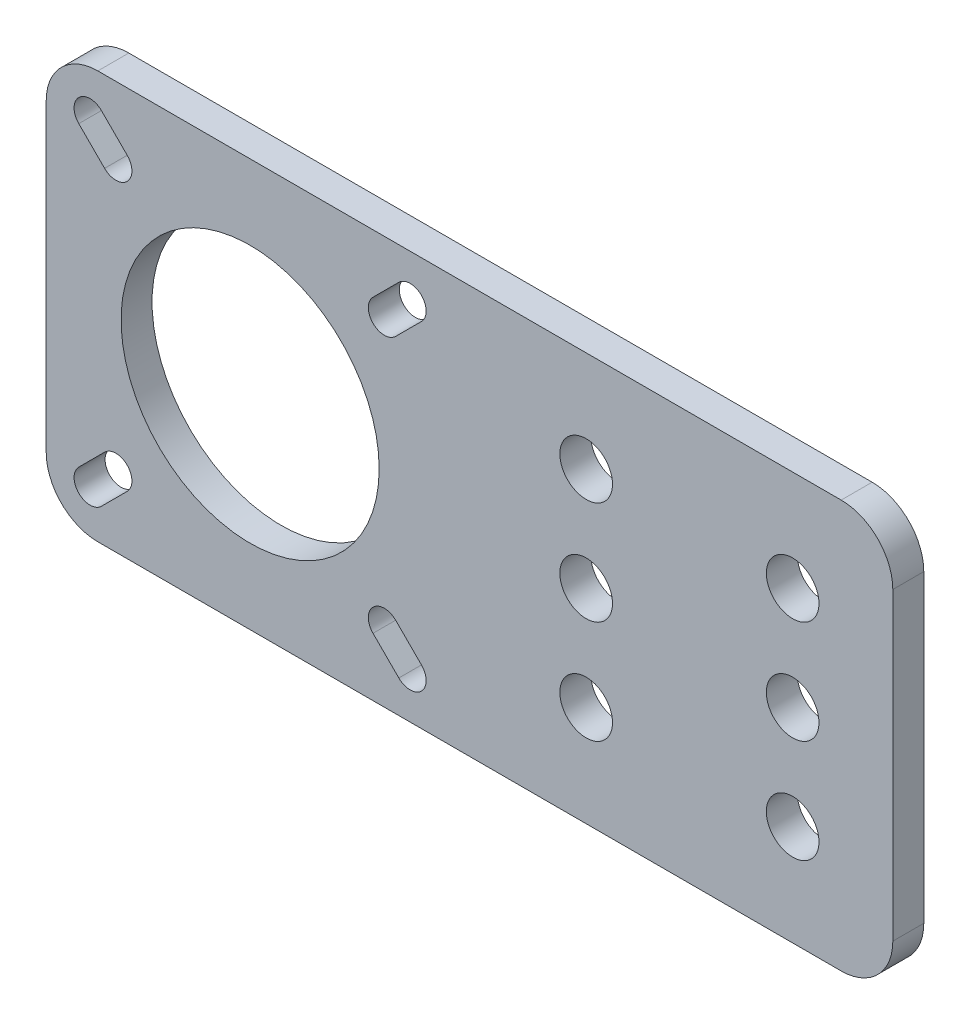
from build123d import *

# Parameters (mm, degrees)
SKETCH1_W           = 82
SKETCH1_H           = 39.5
SKETCH1_R           = 12.5
SKETCH1_R_2         = 2.55
BOSS_EXTRUDE1_DEPTH = 3
FILLET1_R           = 5


with BuildPart() as part:
    # Sketch1 → Boss-Extrude1 (new body)
    with BuildSketch(Plane.XY):
        with Locations((41, 19.75)):
            Rectangle(SKETCH1_W, SKETCH1_H)
        with Locations((19.75, 19.75)):
            Circle(SKETCH1_R, mode=Mode.SUBTRACT)
        with Locations((52.3, 19.75)):
            Circle(SKETCH1_R_2, mode=Mode.SUBTRACT)
        with Locations((52.3, 29.75)):
            Circle(SKETCH1_R_2, mode=Mode.SUBTRACT)
        with Locations((52.3, 9.75)):
            Circle(SKETCH1_R_2, mode=Mode.SUBTRACT)
        with Locations(Location((72.3, 9.75, 0), (0, 0, 180))):
            Circle(SKETCH1_R_2, mode=Mode.SUBTRACT)
        with Locations(Location((72.3, 19.75, 0), (0, 0, 180))):
            Circle(SKETCH1_R_2, mode=Mode.SUBTRACT)
        with Locations(Location((72.3, 29.75, 0), (0, 0, 180))):
            Circle(SKETCH1_R_2, mode=Mode.SUBTRACT)
        with BuildLine():
            Line((5.346015511, 36.346015511), (7.846015511, 33.846015511))
            ThreePointArc((7.846015511, 33.846015511), (7.846015511, 31.653984489), (5.653984489, 31.653984489))
            Line((5.653984489, 31.653984489), (3.153984489, 34.153984489))
            ThreePointArc((3.153984489, 34.153984489), (3.153984489, 36.346015511), (5.346015511, 36.346015511))
        make_face(mode=Mode.SUBTRACT)
        with BuildLine():
            Line((34.153984489, 36.346015511), (31.653984489, 33.846015511))
            ThreePointArc((31.653984489, 33.846015511), (31.653984489, 31.653984489), (33.846015511, 31.653984489))
            Line((33.846015511, 31.653984489), (36.346015511, 34.153984489))
            ThreePointArc((36.346015511, 34.153984489), (36.346015511, 36.346015511), (34.153984489, 36.346015511))
        make_face(mode=Mode.SUBTRACT)
        with BuildLine():
            Line((34.153984489, 3.153984489), (31.653984489, 5.653984489))
            ThreePointArc((31.653984489, 5.653984489), (31.653984489, 7.846015511), (33.846015511, 7.846015511))
            Line((33.846015511, 7.846015511), (36.346015511, 5.346015511))
            ThreePointArc((36.346015511, 5.346015511), (36.346015511, 3.153984489), (34.153984489, 3.153984489))
        make_face(mode=Mode.SUBTRACT)
        with BuildLine():
            Line((5.346015511, 3.153984489), (7.846015511, 5.653984489))
            ThreePointArc((7.846015511, 5.653984489), (7.846015511, 7.846015511), (5.653984489, 7.846015511))
            Line((5.653984489, 7.846015511), (3.153984489, 5.346015511))
            ThreePointArc((3.153984489, 5.346015511), (3.153984489, 3.153984489), (5.346015511, 3.153984489))
        make_face(mode=Mode.SUBTRACT)
    extrude(amount=BOSS_EXTRUDE1_DEPTH)

    # Fillet1
    fillet1_edges = [part.edges().sort_by_distance(p)[0] for p in [
        (0, 39.5, 1.5),
        (82, 39.5, 1.5),
        (82, 0, 1.5),
        (0, 0, 1.5),
    ]]
    fillet(fillet1_edges, radius=FILLET1_R)


solid = part.part
